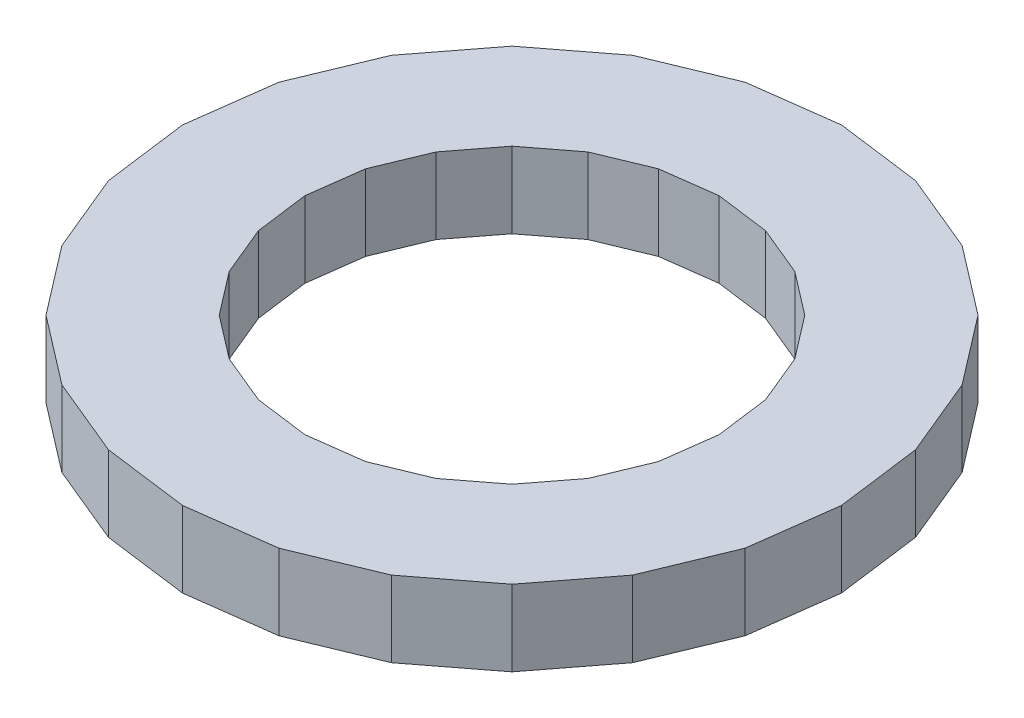
from build123d import *

# Parameters (mm, degrees)
BOSS_EXTRUDE3_DEPTH = 19.05


with BuildPart() as part:
    # Sketch3 → Boss-Extrude3 (new body)
    with BuildSketch(Plane(origin=(0, 0, 0), x_dir=(1, 0, 0), z_dir=(0, 1, 0))):
        Polygon((-82.703707328, 0), (-79.885646838, -21.405294557), (-71.623511533, -41.351853664), (-58.480352281, -58.480352281), (-41.351853664, -71.623511533), (-21.405294557, -79.885646838), (0, -82.703707328), (21.405294557, -79.885646838), (41.351853664, -71.623511533), (58.480352281, -58.480352281), (71.623511533, -41.351853664), (79.885646838, -21.405294557), (82.703707328, 0), (79.885646838, 21.405294557), (71.623511533, 41.351853664), (58.480352281, 58.480352281), (41.351853664, 71.623511533), (21.405294557, 79.885646838), (0, 82.703707328), (-21.405294557, 79.885646838), (-41.351853664, 71.623511533), (-58.480352281, 58.480352281), (-71.623511533, 41.351853664), (-79.885646838, 21.405294557), align=None)
        Polygon((-51.960696609, 0), (-50.190178807, -13.448417879), (-44.999283262, -25.980348305), (-36.741760928, -36.741760928), (-25.980348305, -44.999283262), (-13.448417879, -50.190178807), (0, -51.960696609), (13.448417879, -50.190178807), (25.980348305, -44.999283262), (36.741760928, -36.741760928), (44.999283262, -25.980348305), (50.190178807, -13.448417879), (51.960696609, 0), (50.190178807, 13.448417879), (44.999283262, 25.980348305), (36.741760928, 36.741760928), (25.980348305, 44.999283262), (13.448417879, 50.190178807), (0, 51.960696609), (-13.448417879, 50.190178807), (-25.980348305, 44.999283262), (-36.741760928, 36.741760928), (-44.999283262, 25.980348305), (-50.190178807, 13.448417879), align=None, mode=Mode.SUBTRACT)
    extrude(amount=BOSS_EXTRUDE3_DEPTH)


solid = part.part
